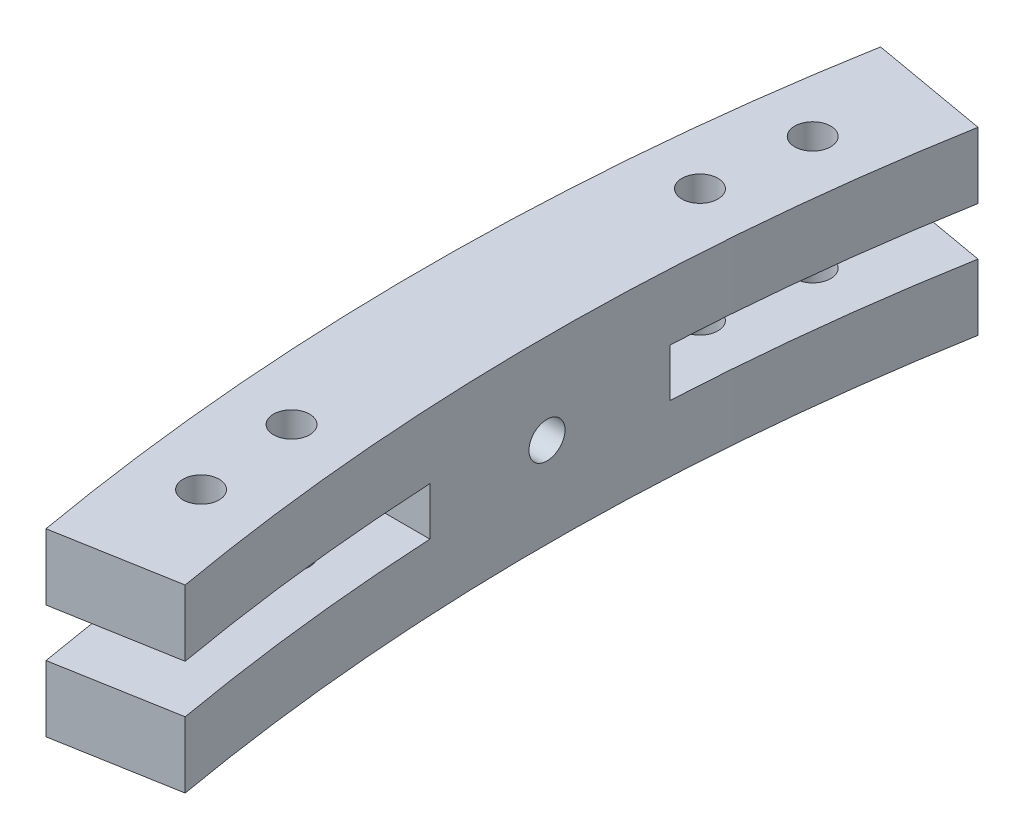
from build123d import *

# Parameters (mm, degrees)
BASE_DEPTH            = 7.5
MOUNT_START           = -2
MOUNT_DEPTH           = 4
MOUNT_HOLE_DEPTH      = 204.131478566
MOUNT_HOLE_DEPTH_BACK = 204.131478566
SKETCH12_R            = 1.5
SKETCH14_R            = 1.5
SHAFT_HOLE_DEPTH      = 37.394984425
SKETCH13_W            = 2.5
SKETCH13_H            = 3


with BuildPart() as part:
    # Sketch9 → base (new, symmetric)
    with BuildSketch(Plane(origin=(0, 0, 0), x_dir=(1, 0, 0), z_dir=(0, 1, 0))):
        with BuildLine():
            ThreePointArc((-187.113473072, -32.993153757), (-190, 0), (-187.113473072, 32.993153757))
            Line((-187.113473072, 32.993153757), (-196.961550602, 34.729635533))
            ThreePointArc((-196.961550602, 34.729635533), (-200, 0), (-196.961550602, -34.729635533))
            Line((-196.961550602, -34.729635533), (-187.113473072, -32.993153757))
        make_face()
    extrude(amount=BASE_DEPTH, both=True)

    # Sketch11 → mount (cut)
    with BuildSketch(Plane(origin=(0, 0, 0), x_dir=(1, 0, 0), z_dir=(0, 1, 0)).offset(MOUNT_START)):
        with BuildLine():
            Line((-189.73665961, -10), (-199.749843554, -10))
            ThreePointArc((-199.749843554, -10), (-198.7407137, -22.408228804), (-196.961550602, -34.729635533))
            Line((-196.961550602, -34.729635533), (-187.113473072, -32.993153757))
            ThreePointArc((-187.113473072, -32.993153757), (-188.775466906, -21.536552519), (-189.73665961, -10))
        make_face()
        with BuildLine():
            Line((-189.73665961, 10), (-199.749843554, 10))
            ThreePointArc((-199.749843554, 10), (-198.7407137, 22.408228804), (-196.961550602, 34.729635533))
            Line((-196.961550602, 34.729635533), (-187.113473072, 32.993153757))
            ThreePointArc((-187.113473072, 32.993153757), (-188.775466906, 21.536552519), (-189.73665961, 10))
        make_face()
    extrude(amount=MOUNT_DEPTH, mode=Mode.SUBTRACT)

    # Sketch12 → mount hole (cut, two sides: drawn at the far end of the back side and taken through both)
    with BuildSketch(Plane(origin=(0, 0, 0), x_dir=(1, 0, 0), z_dir=(0, 1, 0)).offset(-MOUNT_HOLE_DEPTH_BACK)):
        with Locations(Location((-193.331747968, 25.452607483, 0), (0, 0, 270))):
            Circle(SKETCH12_R)
        with Locations(Location((-194.257966128, 16.995369836, 0), (0, 0, 270))):
            Circle(SKETCH12_R)
        with Locations(Location((-194.257966128, -16.995369836, 0), (0, 0, 270))):
            Circle(SKETCH12_R)
        with Locations(Location((-193.331747968, -25.452607483, 0), (0, 0, 270))):
            Circle(SKETCH12_R)
    extrude(amount=MOUNT_HOLE_DEPTH + MOUNT_HOLE_DEPTH_BACK, mode=Mode.SUBTRACT)

    # Sketch14 → shaft hole (cut, through all)
    with BuildSketch(Plane.ZY.offset(195)):
        Circle(SKETCH14_R)
    extrude(amount=-SHAFT_HOLE_DEPTH, mode=Mode.SUBTRACT)

    # Sketch13 → bearing hole (revolve, cut)
    with BuildSketch(Plane(origin=(0, 0, 0), x_dir=(1, 0, 0), z_dir=(0, 1, 0)), mode=Mode.PRIVATE) as bearing_hole_sk:
        with Locations((-195, 1.5)):
            Rectangle(SKETCH13_W, SKETCH13_H)
    revolve(bearing_hole_sk.sketch.rotate(Axis((0, 0, 0), (-1, 0, 0)), 180), axis=Axis((0, 0, 0), (-1, 0, 0)), mode=Mode.SUBTRACT)


solid = part.part
